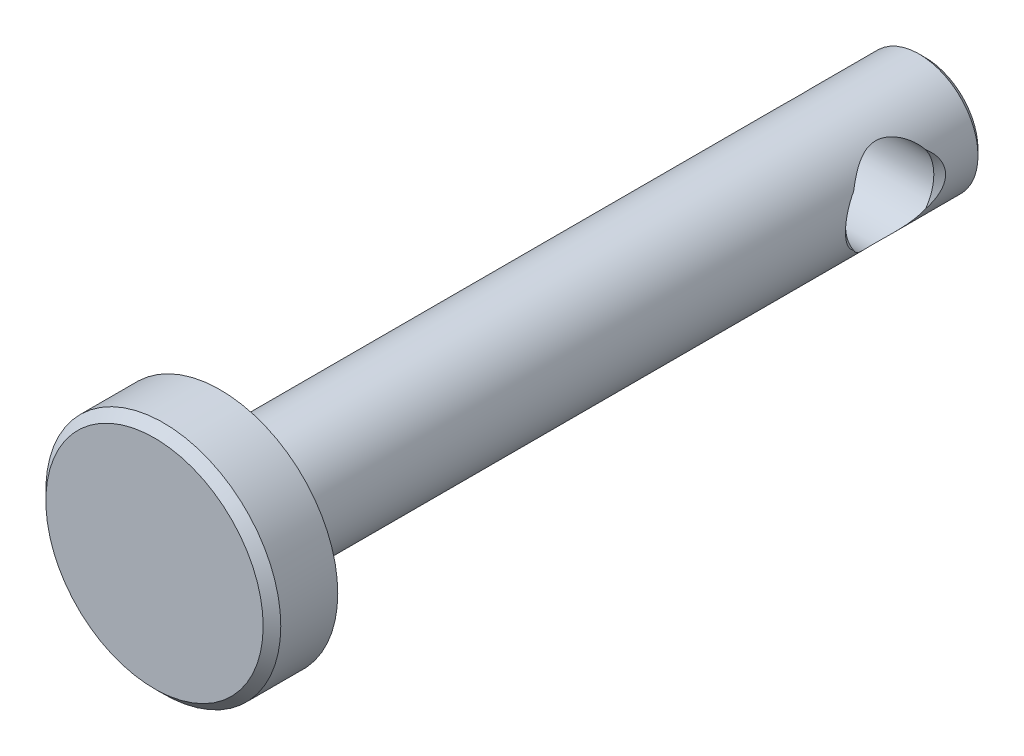
from build123d import *

# Parameters (mm, degrees)
CUT_EXTRUDE1_DEPTH      = 12.340751562
CUT_EXTRUDE1_DEPTH_BACK = 12.340751562
SKETCH3_R               = 1.1938
FILLET1_R               = 0.1190625


with BuildPart() as part:
    # Sketch2 → Revolve1 (revolve)
    with BuildSketch(Plane(origin=(0, 0, 0), x_dir=(0, 0, -1), z_dir=(1, 0, 0))):
        Polygon((10.25525, 1.5875), (-8.636, 1.5875), (-8.636, 3.175), (-10.175875, 3.175), (-10.414, 2.936875), (-10.414, 0), (10.414, 0), (10.414, 1.42875), align=None)
    revolve(axis=Axis((0, 0, 10.414), (0, 0, -1)))

    # Sketch3 → Cut-Extrude1 (cut, two sides: drawn at the far end of the back side and taken through both)
    with BuildSketch(Plane(origin=(0, 0, 0), x_dir=(0, 0, -1), z_dir=(1, 0, 0)).offset(-CUT_EXTRUDE1_DEPTH_BACK)):
        with Locations((8.0264, 0)):
            Circle(SKETCH3_R)
    extrude(amount=CUT_EXTRUDE1_DEPTH + CUT_EXTRUDE1_DEPTH_BACK, mode=Mode.SUBTRACT)

    # Fillet1
    fillet1_edges = [part.edges().sort_by_distance(p)[0] for p in [
        (0, -1.5875, 8.636),
    ]]
    fillet(fillet1_edges, radius=FILLET1_R)

    # Sketch4 → Cut-Revolve1 (revolve, cut)
    with BuildSketch(Plane(origin=(0, 0, 0), x_dir=(1, 0, 0), z_dir=(0, 1, 0))):
        Polygon((-1.5875, 9.37895), (-1.27, 9.06145), (-1.5875, 9.06145), align=None)
        Polygon((1.5875, 9.06145), (1.5875, 9.37895), (1.27, 9.06145), align=None)
    revolve(axis=Axis((0, 0, -8.0264), (-1, 0, 0)), mode=Mode.SUBTRACT)


solid = part.part
